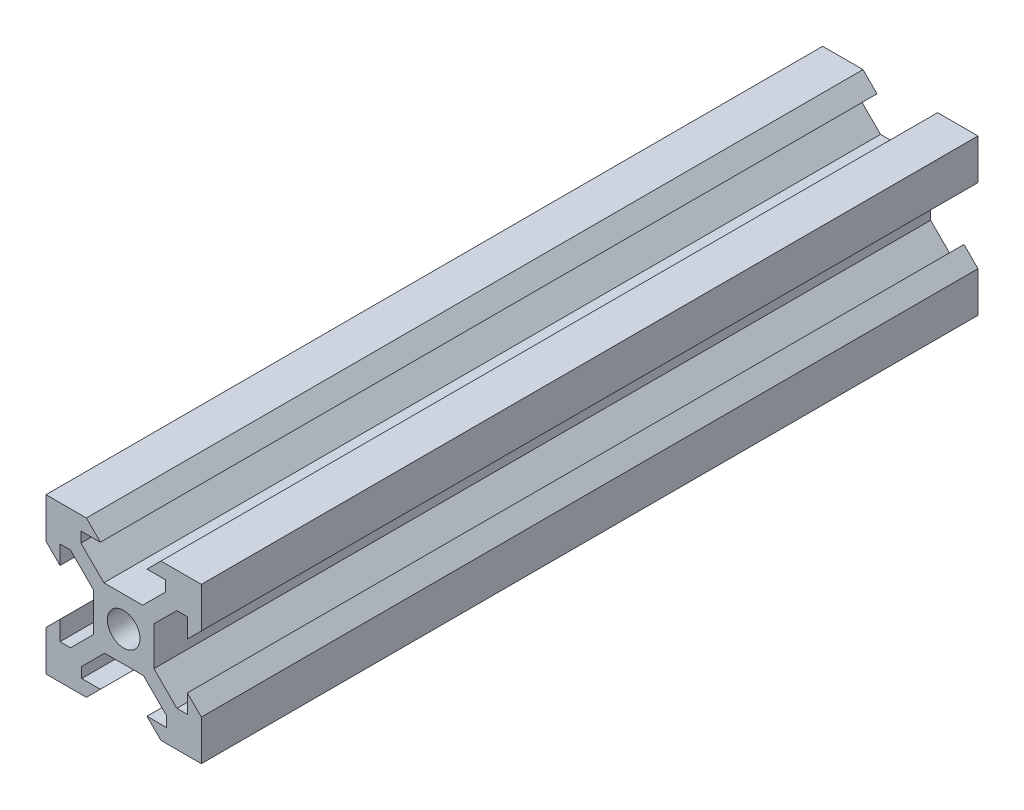
from build123d import *

# Parameters (mm, degrees)
CROQUIS1_R              = 2.1
SALIENTE_EXTRUIR1_DEPTH = 100


with BuildPart() as part:
    # Croquis1 → Saliente-Extruir1 (new body)
    with BuildSketch(Plane.XY):
        Polygon((3, 8.2), (5.4, 8.2), (5.4, 6.85), (2.45, 3.9), (-2.55, 3.9), (-5.5, 6.85), (-5.5, 8.2), (-3, 8.2), (-4.8, 10), (-10, 10), (-10, 4.8), (-8.2, 3), (-8.2, 5.4), (-6.85, 5.4), (-3.9, 2.45), (-3.9, -2.55), (-6.85, -5.5), (-8.2, -5.5), (-8.2, -3), (-10, -4.8), (-10, -10), (-4.8, -10), (-3, -8.2), (-5.4, -8.2), (-5.4, -6.85), (-2.45, -3.9), (2.55, -3.9), (5.5, -6.85), (5.5, -8.2), (3, -8.2), (4.8, -10), (10, -10), (10, -4.8), (8.2, -3), (8.2, -5.4), (6.85, -5.4), (3.9, -2.45), (3.9, 2.55), (6.85, 5.5), (8.2, 5.5), (8.2, 3), (10, 4.8), (10, 10), (4.8, 10), align=None)
        Circle(CROQUIS1_R, mode=Mode.SUBTRACT)
    extrude(amount=SALIENTE_EXTRUIR1_DEPTH)


solid = part.part
